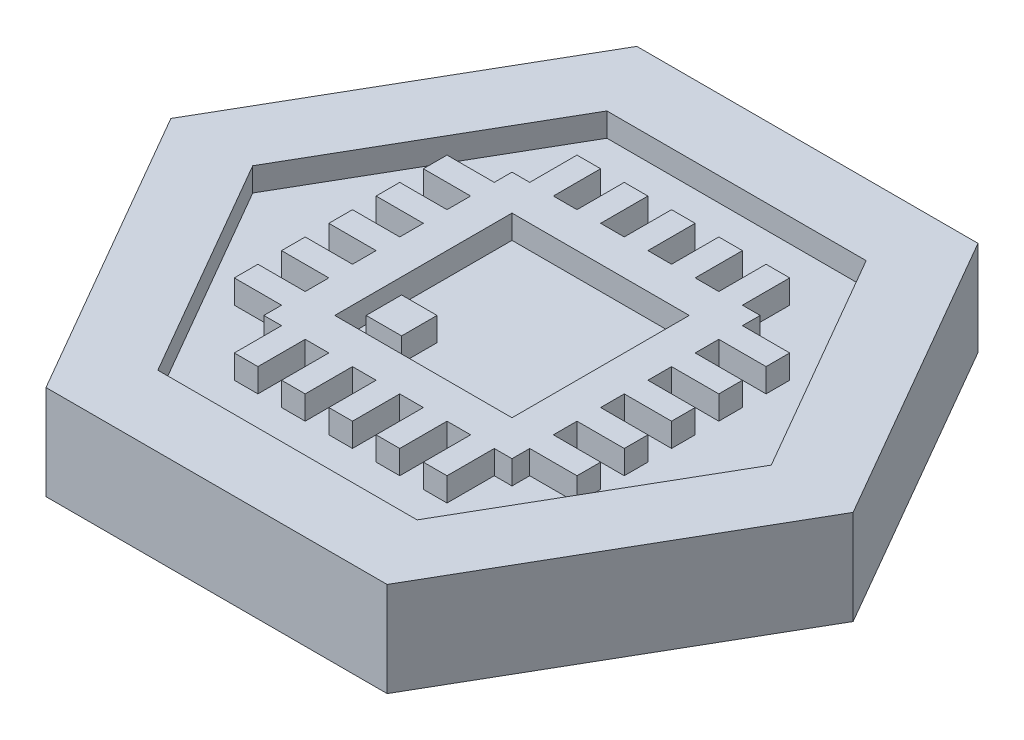
from build123d import *

# Parameters (mm, degrees)
EXTRUDE_1_DEPTH     = 4
CUT_EXTRUDE_1_DEPTH = 1
SKETCH_3_W          = 7.5
SKETCH_3_H          = 7.5
EXTRUDE_2_DEPTH     = 1
SKETCH_4_W          = 1.5
SKETCH_4_H          = 1.5
EXTRUDE_3_DEPTH     = 1


with BuildPart() as part:
    # 草图1 → 凸台-拉伸1 (new body)
    with BuildSketch(Plane(origin=(0, 0, 0), x_dir=(1, 0, 0), z_dir=(0, 1, 0))):
        Polygon((14.43375673, 0), (7.216878365, 12.5), (-7.216878365, 12.5), (-14.43375673, 0), (-7.216878365, -12.5), (7.216878365, -12.5), align=None)
    extrude(amount=EXTRUDE_1_DEPTH)

    # 草图2 → 切除-拉伸1 (cut)
    with BuildSketch(Plane(origin=(0, 4, 0), x_dir=(1, 0, 0), z_dir=(0, 1, 0))):
        Polygon((5.484827557, -9.5), (10.969655115, 0), (5.484827557, 9.5), (-5.484827557, 9.5), (-10.969655115, 0), (-5.484827557, -9.5), align=None)
    extrude(amount=-CUT_EXTRUDE_1_DEPTH, mode=Mode.SUBTRACT)

    # 草图3 → 凸台-拉伸2 (add)
    with BuildSketch(Plane(origin=(0, 3, 0), x_dir=(1, 0, 0), z_dir=(0, 1, 0))):
        Polygon((7.25, -3.5), (5.25, -3.5), (5.25, -2.5), (7.25, -2.5), (7.25, -1.5), (5.25, -1.5), (5.25, -0.5), (7.25, -0.5), (7.25, 0.5), (5.25, 0.5), (5.25, 1.5), (7.25, 1.5), (7.25, 2.5), (5.25, 2.5), (5.25, 3.5), (7.25, 3.5), (7.25, 4.5), (5.25, 4.5), (5.25, 5.25), (4.5, 5.25), (4.5, 7.25), (3.5, 7.25), (3.5, 5.25), (2.5, 5.25), (2.5, 7.25), (1.5, 7.25), (1.5, 5.25), (0.5, 5.25), (0.5, 7.25), (-0.5, 7.25), (-0.5, 5.25), (-1.5, 5.25), (-1.5, 7.25), (-2.5, 7.25), (-2.5, 5.25), (-3.5, 5.25), (-3.5, 7.25), (-4.5, 7.25), (-4.5, 5.25), (-5.25, 5.25), (-5.25, 4.5), (-7.25, 4.5), (-7.25, 3.5), (-5.25, 3.5), (-5.25, 2.5), (-7.25, 2.5), (-7.25, 1.5), (-5.25, 1.5), (-5.25, 0.5), (-7.25, 0.5), (-7.25, -0.5), (-5.25, -0.5), (-5.25, -1.5), (-7.25, -1.5), (-7.25, -2.5), (-5.25, -2.5), (-5.25, -3.5), (-7.25, -3.5), (-7.25, -4.5), (-5.25, -4.5), (-5.25, -5.25), (-4.5, -5.25), (-4.5, -7.25), (-3.5, -7.25), (-3.5, -5.25), (-2.5, -5.25), (-2.5, -7.25), (-1.5, -7.25), (-1.5, -5.25), (-0.5, -5.25), (-0.5, -7.25), (0.5, -7.25), (0.5, -5.25), (1.5, -5.25), (1.5, -7.25), (2.5, -7.25), (2.5, -5.25), (3.5, -5.25), (3.5, -7.25), (4.5, -7.25), (4.5, -5.25), (5.25, -5.25), (5.25, -4.5), (7.25, -4.5), align=None)
        Rectangle(SKETCH_3_W, SKETCH_3_H, mode=Mode.SUBTRACT)
    extrude(amount=EXTRUDE_2_DEPTH)

    # 草图4 → 凸台-拉伸3 (add)
    with BuildSketch(Plane(origin=(0, 3, 0), x_dir=(1, 0, 0), z_dir=(0, 1, 0))):
        with Locations((-2.335786438, -2.335786438)):
            Rectangle(SKETCH_4_W, SKETCH_4_H)
    extrude(amount=EXTRUDE_3_DEPTH)


solid = part.part
